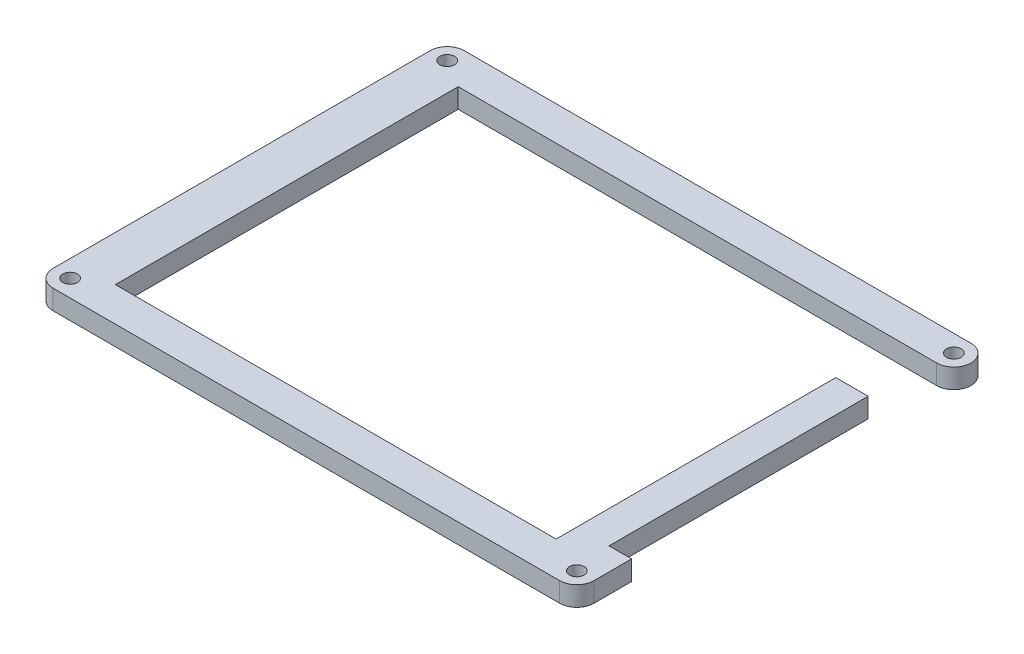
from build123d import *

# Parameters (mm, degrees)
SKETCH1_R           = 1.1938
BOSS_EXTRUDE1_DEPTH = 1.5875
SKETCH2_R           = 1.1938
BOSS_EXTRUDE2_DEPTH = 1.5875
BOSS_EXTRUDE3_DEPTH = 3.175
BOSS_EXTRUDE4_DEPTH = 3.175
SKETCH5_W           = 3.656154394
SKETCH5_H           = 41.933387184
CUT_EXTRUDE1_DEPTH  = 78.415745756


with BuildPart() as part:
    # Sketch1 → Boss-Extrude1 (new, symmetric)
    with BuildSketch(Plane(origin=(0, 0, 0), x_dir=(1, 0, 0), z_dir=(0, 1, 0))):
        with BuildLine():
            Line((-40.9956, 2.7686), (40.9956, 2.7686))
            ThreePointArc((40.9956, 2.7686), (43.7642, 0), (40.9956, -2.7686))
            Line((40.9956, -2.7686), (-40.9956, -2.7686))
            ThreePointArc((-40.9956, -2.7686), (-43.7642, 0), (-40.9956, 2.7686))
        make_face()
        with Locations(Location((-40.9956, 0, 0), (0, 0, 270))):
            Circle(SKETCH1_R, mode=Mode.SUBTRACT)
        with Locations(Location((40.9956, 0, 0), (0, 0, 270))):
            Circle(SKETCH1_R, mode=Mode.SUBTRACT)
    extrude(amount=BOSS_EXTRUDE1_DEPTH, both=True)



with BuildPart() as body_2:
    # Sketch2 → Boss-Extrude2 (new, symmetric)
    with BuildSketch(Plane(origin=(0, 0, 0), x_dir=(1, 0, 0), z_dir=(0, 1, 0))):
        with BuildLine():
            Line((-40.9956, -58.2422), (40.9956, -58.2422))
            ThreePointArc((40.9956, -58.2422), (43.7642, -61.0108), (40.9956, -63.7794))
            Line((40.9956, -63.7794), (-40.9956, -63.7794))
            ThreePointArc((-40.9956, -63.7794), (-43.7642, -61.0108), (-40.9956, -58.2422))
        make_face()
        with Locations(Location((-40.9956, -61.0108, 0), (0, 0, 270))):
            Circle(SKETCH2_R, mode=Mode.SUBTRACT)
        with Locations(Location((40.9956, -61.0108, 0), (0, 0, 270))):
            Circle(SKETCH2_R, mode=Mode.SUBTRACT)
    extrude(amount=BOSS_EXTRUDE2_DEPTH, both=True)


with BuildPart() as part_1:
    add(part.part)

    add(body_2.part)  # Boss-Extrude3 merges body 2
    # Sketch3 → Boss-Extrude3 (add)
    with BuildSketch(Plane(origin=(0, 1.5875, 0), x_dir=(1, 0, 0), z_dir=(0, 1, 0))):
        with BuildLine():
            ThreePointArc((-40.9956, -2.7686), (-42.953295834, -1.957695834), (-43.7642, 0))
            Line((-43.7642, 0), (-43.7642, -61.0108))
            ThreePointArc((-43.7642, -61.0108), (-42.953295834, -59.053104166), (-40.9956, -58.2422))
            Line((-40.9956, -58.2422), (-36.444722592, -58.2422))
            Line((-36.444722592, -58.2422), (-36.444722592, -2.7686))
            Line((-36.444722592, -2.7686), (-40.9956, -2.7686))
        make_face()
    extrude(amount=-BOSS_EXTRUDE3_DEPTH)

    # Sketch4 → Boss-Extrude4 (add)
    with BuildSketch(Plane(origin=(0, 1.5875, 0), x_dir=(1, 0, 0), z_dir=(0, 1, 0))):
        with BuildLine():
            ThreePointArc((40.9956, -58.2422), (42.953295834, -59.053104166), (43.7642, -61.0108))
            Line((43.7642, -61.0108), (43.7642, -12.9794))
            Line((43.7642, -12.9794), (34.8742, -12.9794))
            Line((34.8742, -12.9794), (34.8742, -58.2422))
            Line((34.8742, -58.2422), (40.9956, -58.2422))
        make_face()
    extrude(amount=-BOSS_EXTRUDE4_DEPTH)

    # Sketch5 → Cut-Extrude1 (cut, through all)
    with BuildSketch(Plane(origin=(0, 1.5875, 0), x_dir=(1, 0, 0), z_dir=(0, 1, 0))):
        with Locations((41.936122803, -33.946093592)):
            Rectangle(SKETCH5_W, SKETCH5_H)
    extrude(amount=-CUT_EXTRUDE1_DEPTH, mode=Mode.SUBTRACT)


solid = part_1.part
